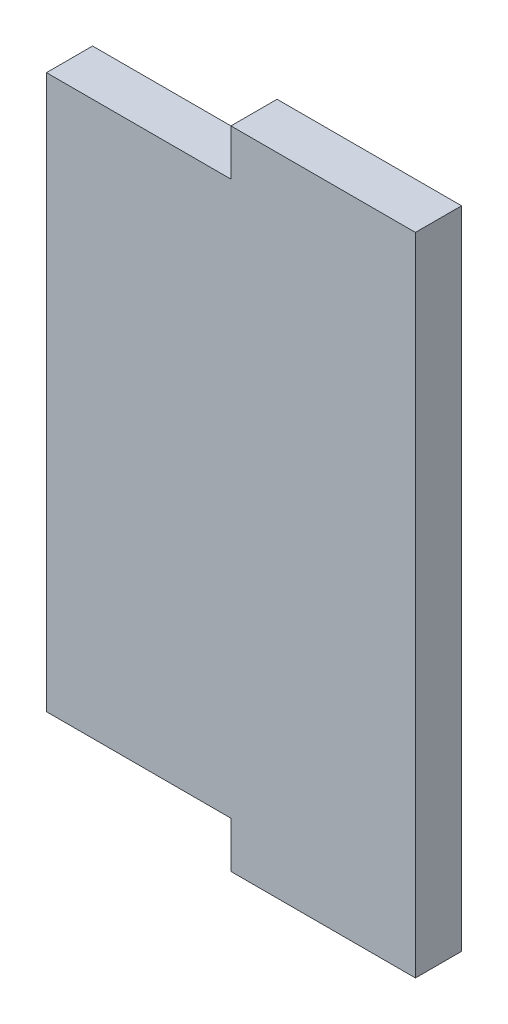
from build123d import *

# Parameters (mm, degrees)
BOSS_EXTRUDE1_DEPTH = 3.175


with BuildPart() as part:
    # Sketch1 → Boss-Extrude1 (new body)
    with BuildSketch(Plane.XY):
        Polygon((136.525, 0), (123.825, 0), (123.825, -3.175), (111.125, -3.175), (111.125, -41.275), (123.825, -41.275), (123.825, -44.45), (136.525, -44.45), align=None)
    extrude(amount=BOSS_EXTRUDE1_DEPTH)


solid = part.part
